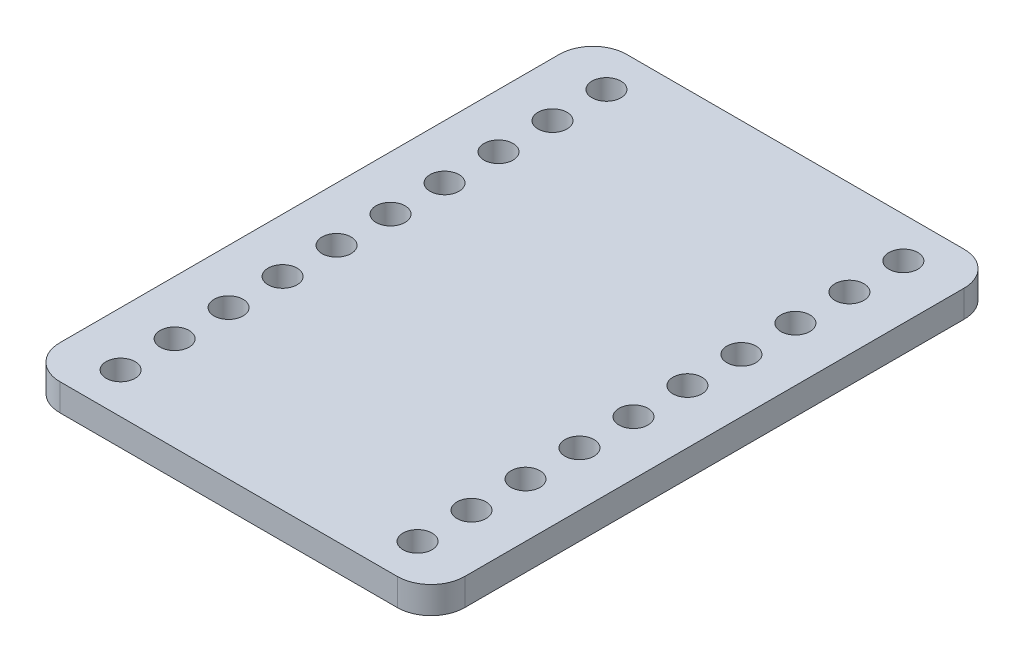
from build123d import *

# Parameters (mm, degrees)
SKETCH2_W           = 60
SKETCH2_H           = 84
SKETCH2_R           = 2.15
BOSS_EXTRUDE2_DEPTH = 4
FILLET2_R           = 5


with BuildPart() as part:
    # Sketch2 → Boss-Extrude2 (new body)
    with BuildSketch(Plane(origin=(0, 0, 0), x_dir=(1, 0, 0), z_dir=(0, 1, 0))):
        Rectangle(SKETCH2_W, SKETCH2_H)
        with Locations(Location((-22, 36, 0), (0, 0, 270))):
            Circle(SKETCH2_R, mode=Mode.SUBTRACT)
        with Locations(Location((22, 36, 0), (0, 0, 270))):
            Circle(SKETCH2_R, mode=Mode.SUBTRACT)
        with Locations(Location((22, 28, 0), (0, 0, 270))):
            Circle(SKETCH2_R, mode=Mode.SUBTRACT)
        with Locations(Location((22, 20, 0), (0, 0, 270))):
            Circle(SKETCH2_R, mode=Mode.SUBTRACT)
        with Locations(Location((22, 12, 0), (0, 0, 270))):
            Circle(SKETCH2_R, mode=Mode.SUBTRACT)
        with Locations(Location((22, 4, 0), (0, 0, 270))):
            Circle(SKETCH2_R, mode=Mode.SUBTRACT)
        with Locations(Location((22, -4, 0), (0, 0, 270))):
            Circle(SKETCH2_R, mode=Mode.SUBTRACT)
        with Locations(Location((22, -12, 0), (0, 0, 270))):
            Circle(SKETCH2_R, mode=Mode.SUBTRACT)
        with Locations(Location((22, -20, 0), (0, 0, 270))):
            Circle(SKETCH2_R, mode=Mode.SUBTRACT)
        with Locations(Location((22, -28, 0), (0, 0, 270))):
            Circle(SKETCH2_R, mode=Mode.SUBTRACT)
        with Locations(Location((22, -36, 0), (0, 0, 270))):
            Circle(SKETCH2_R, mode=Mode.SUBTRACT)
        with Locations(Location((-22, 28, 0), (0, 0, 270))):
            Circle(SKETCH2_R, mode=Mode.SUBTRACT)
        with Locations(Location((-22, 20, 0), (0, 0, 270))):
            Circle(SKETCH2_R, mode=Mode.SUBTRACT)
        with Locations(Location((-22, 12, 0), (0, 0, 270))):
            Circle(SKETCH2_R, mode=Mode.SUBTRACT)
        with Locations(Location((-22, 4, 0), (0, 0, 270))):
            Circle(SKETCH2_R, mode=Mode.SUBTRACT)
        with Locations(Location((-22, -4, 0), (0, 0, 270))):
            Circle(SKETCH2_R, mode=Mode.SUBTRACT)
        with Locations(Location((-22, -12, 0), (0, 0, 270))):
            Circle(SKETCH2_R, mode=Mode.SUBTRACT)
        with Locations(Location((-22, -20, 0), (0, 0, 270))):
            Circle(SKETCH2_R, mode=Mode.SUBTRACT)
        with Locations(Location((-22, -28, 0), (0, 0, 270))):
            Circle(SKETCH2_R, mode=Mode.SUBTRACT)
        with Locations(Location((-22, -36, 0), (0, 0, 270))):
            Circle(SKETCH2_R, mode=Mode.SUBTRACT)
    extrude(amount=BOSS_EXTRUDE2_DEPTH)

    # Fillet2
    fillet2_edges = [part.edges().sort_by_distance(p)[0] for p in [
        (30, 2, 42),
        (-30, 2, 42),
        (-30, 2, -42),
        (30, 2, -42),
    ]]
    fillet(fillet2_edges, radius=FILLET2_R)


solid = part.part
